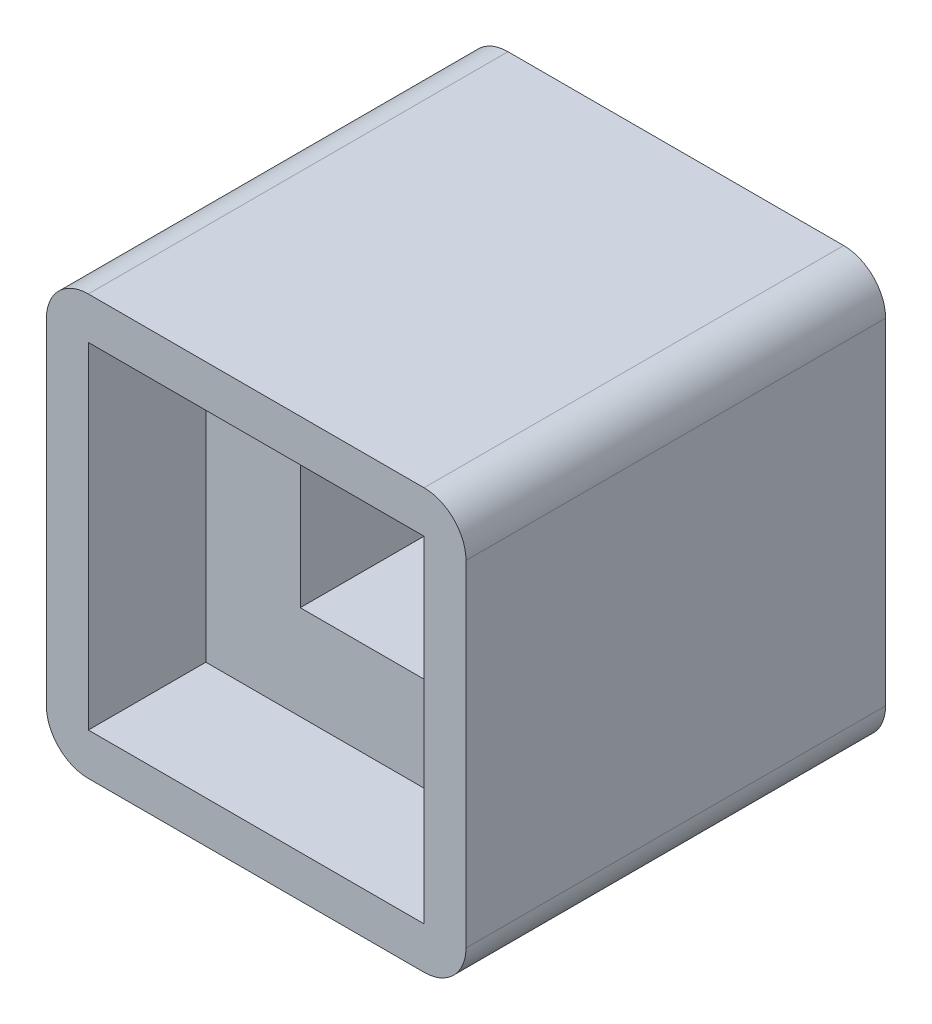
from build123d import *

# Parameters (mm, degrees)
SKETCH_1_W                = 100
SKETCH_1_H                = 100
EXTRUDE_1_DEPTH           = 100
SKETCH_2_R                = 46
CUT_EXTRUDE_1_DEPTH       = 15
FILLET_1_R                = 10
CUT_EXTRUDE_2_DEPTH       = 8
SKETCH_8_W                = 80
SKETCH_8_H                = 80
CUT_EXTRUDE_7_DEPTH       = 28
SKETCH_9_W                = 35
SKETCH_9_H                = 35
CUT_EXTRUDE_8_DEPTH       = 33
SKETCH_10_R               = 2.5
CUT_EXTRUDE_9_DEPTH       = 4
CUT_EXTRUDE_10_DEPTH      = 163.975458275
CUT_EXTRUDE_10_DEPTH_BACK = 20
SKETCH_11_R               = 1


with BuildPart() as part:
    # 草图1 → 凸台-拉伸1 (new body)
    with BuildSketch(Plane(origin=(0, 0, 0), x_dir=(1, 0, 0), z_dir=(0, 1, 0))):
        with Locations((50, 50)):
            Rectangle(SKETCH_1_W, SKETCH_1_H)
    extrude(amount=EXTRUDE_1_DEPTH)

    # 草图2 → 切除-拉伸1 (cut)
    with BuildSketch(Plane(origin=(0, 0, -100), x_dir=(-1, 0, 0), z_dir=(0, 0, -1))):
        with Locations((-50, 50)):
            Circle(SKETCH_2_R)
    extrude(amount=-CUT_EXTRUDE_1_DEPTH, mode=Mode.SUBTRACT)

    # 圆角1
    fillet_1_edges = [part.edges().sort_by_distance(p)[0] for p in [
        (100, 100, -50),
        (0, 100, -50),
        (100, 0, -50),
        (0, 0, -50),
    ]]
    fillet(fillet_1_edges, radius=FILLET_1_R)

    # 草图3 → 切除-拉伸2 (cut)
    with BuildSketch(Plane(origin=(0, 0, -85), x_dir=(-1, 0, 0), z_dir=(0, 0, -1))):
        with BuildLine():
            Line((-61.860285343, 26.862722036), (-69.615087298, 11.734501829))
            ThreePointArc((-69.615087298, 11.734501829), (-50, 7), (-30.384912702, 11.734501829))
            Line((-30.384912702, 11.734501829), (-38.139714657, 26.862722036))
            ThreePointArc((-38.139714657, 26.862722036), (-50, 24), (-61.860285343, 26.862722036))
        make_face()
    extrude(amount=-CUT_EXTRUDE_2_DEPTH, mode=Mode.SUBTRACT)

    # 草图6 → section 1 of loft_1
    with BuildSketch(Plane(origin=(0, 0, -65), x_dir=(-1, 0, 0), z_dir=(0, 0, -1)), mode=Mode.PRIVATE) as loft_1_s1:
        with BuildLine():
            Line((-69.615087298, 11.734501829), (-65.965768731, 18.853664279))
            ThreePointArc((-65.965768731, 18.853664279), (-50, 15), (-34.034231269, 18.853664279))
            Line((-34.034231269, 18.853664279), (-30.384912702, 11.734501829))
            ThreePointArc((-30.384912702, 11.734501829), (-50, 7), (-69.615087298, 11.734501829))
        make_face()
    # loft from a face of the part (loft_1)
    loft([part.faces().sort_by_distance((50, 16.103496225, -77))[0], loft_1_s1.sketch], mode=Mode.SUBTRACT)

    # 草图6<3> for 切除-放样3 → 切除-放样3 section 0
    with BuildSketch(Plane(origin=(0, 0, -65), x_dir=(-1, 0, 0), z_dir=(0, 0, -1))):
        with BuildLine():
            Line((-69.615087298, 11.734501829), (-65.965768731, 18.853664279))
            # circular arc as an exact rational Bezier (weights 1, cos(half-angle), 1)
            Bezier((-65.965768731, 18.853664279), (-50, 10.669530728), (-34.034231269, 18.853664279), weights=[1, 0.889895306, 1])
            Line((-34.034231269, 18.853664279), (-30.384912702, 11.734501829))
            Bezier((-30.384912702, 11.734501829), (-50, 1.67970918), (-69.615087298, 11.734501829), weights=[1, 0.889895306, 1])
        make_face()
    # 草图7 → 切除-放样3 section 1
    with BuildSketch(Plane.XZ):
        with BuildLine():
            Line((65.965768731, -60.646196457), (34.034231269, -60.646196457))
            Line((34.034231269, -60.646196457), (38.139714657, -45.646196457))
            Line((38.139714657, -45.646196457), (61.860285343, -45.646196457))
            Line((61.860285343, -45.646196457), (65.965768731, -60.646196457))
        make_face()
    loft(mode=Mode.SUBTRACT)

    # 草图8 → 切除-拉伸7 (cut)
    with BuildSketch(Plane.XY):
        with Locations((50, 50)):
            Rectangle(SKETCH_8_W, SKETCH_8_H)
    extrude(amount=-CUT_EXTRUDE_7_DEPTH, mode=Mode.SUBTRACT)

    # 草图9 → 切除-拉伸8 (cut)
    with BuildSketch(Plane.XY.offset(-28)):
        with Locations((50, 50)):
            Rectangle(SKETCH_9_W, SKETCH_9_H)
    extrude(amount=-CUT_EXTRUDE_8_DEPTH, mode=Mode.SUBTRACT)

    # 草图10 → 切除-拉伸9 (cut)
    with BuildSketch(Plane(origin=(0, 0, -85), x_dir=(-1, 0, 0), z_dir=(0, 0, -1))):
        with Locations((-36.918524548, 36.918524548)):
            Circle(SKETCH_10_R)
        with Locations(Location((-36.918524548, 63.081475452, 0), (0, 0, 180))):
            Circle(SKETCH_10_R)
        with Locations(Location((-63.081475452, 36.918524548, 0), (0, 0, 180))):
            Circle(SKETCH_10_R)
        with Locations((-63.081475452, 63.081475452)):
            Circle(SKETCH_10_R)
    extrude(amount=-CUT_EXTRUDE_9_DEPTH, mode=Mode.SUBTRACT)

    # 草图11 → 切除-拉伸10 (cut, two sides: drawn at the far end of the back side and taken through both)
    with BuildSketch(Plane(origin=(0, 0, -81), x_dir=(-1, 0, 0), z_dir=(0, 0, -1)).offset(-CUT_EXTRUDE_10_DEPTH_BACK)):
        with Locations((-63.081475452, 63.081475452)):
            Circle(SKETCH_11_R)
        with Locations(Location((-36.918524548, 63.081475452, 0), (0, 0, 180))):
            Circle(SKETCH_11_R)
        with Locations(Location((-63.081475452, 36.918524548, 0), (0, 0, 180))):
            Circle(SKETCH_11_R)
        with Locations((-36.918524548, 36.918524548)):
            Circle(SKETCH_11_R)
    extrude(amount=CUT_EXTRUDE_10_DEPTH + CUT_EXTRUDE_10_DEPTH_BACK, mode=Mode.SUBTRACT)


solid = part.part
